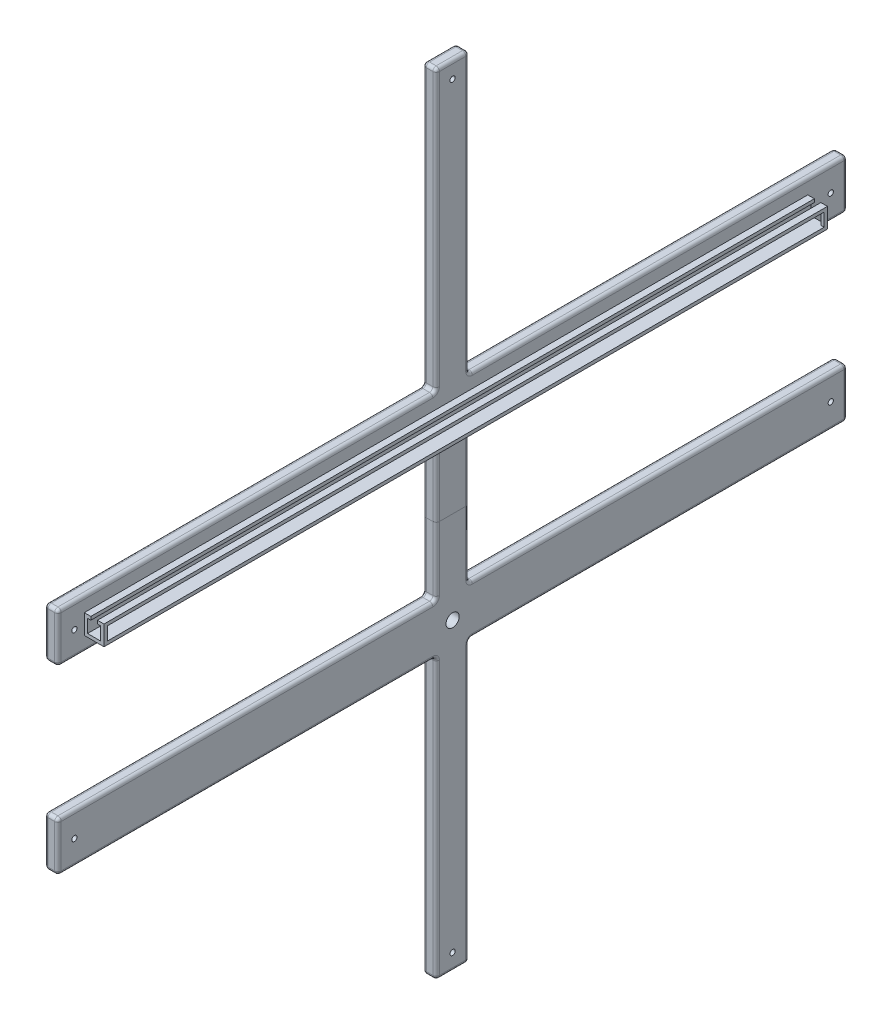
from build123d import *

# Parameters (mm, degrees)
BOSS_EXTRUDE1_DEPTH     = 4
CUT_EXTRUDE1_DEPTH      = 4
CUT_EXTRUDE1_DEPTH_BACK = 4
SKETCH4_R               = 0.8
SKETCH4_R_2             = 2
FILLET1_R               = 1
BOSS_EXTRUDE5_DEPTH     = 220
SKETCH9_W               = 218
SKETCH9_H               = 4
CUT_EXTRUDE2_DEPTH      = 2


with BuildPart() as part:
    # Sketch3 → Boss-Extrude1 (new body)
    with BuildSketch(Plane(origin=(0, 0, 0), x_dir=(0, 0, -1), z_dir=(1, 0, 0))):
        Polygon((-151.031128477, 58.486176731), (-36.031128477, 58.486176731), (-36.031128477, 43.486176731), (-151.031128477, 43.486176731), (-151.031128477, 3.486176731), (-36.031128477, 3.486176731), (-36.031128477, -11.513823269), (-151.031128477, -11.513823269), (-151.031128477, -96.513823269), (-161.031128477, -96.513823269), (-161.031128477, -11.513823269), (-276.031128477, -11.513823269), (-276.031128477, 3.486176731), (-161.031128477, 3.486176731), (-161.031128477, 43.486176731), (-276.031128477, 43.486176731), (-276.031128477, 58.486176731), (-161.031128477, 58.486176731), (-161.031128477, 143.486176731), (-151.031128477, 143.486176731), align=None)
    extrude(amount=BOSS_EXTRUDE1_DEPTH)

    # Sketch4 → Cut-Extrude1 (cut, two sides: drawn at the far end of the back side and taken through both)
    with BuildSketch(Plane(origin=(0, 0, 0), x_dir=(0, 0, -1), z_dir=(1, 0, 0)).offset(-CUT_EXTRUDE1_DEPTH_BACK)):
        with Locations((-156.031128477, -91.513823269)):
            Circle(SKETCH4_R)
        with Locations((-156.031128477, 138.486176731)):
            Circle(SKETCH4_R)
        with Locations((-271.031128477, -4.013823269)):
            Circle(SKETCH4_R)
        with Locations((-271.031128477, 50.986176731)):
            Circle(SKETCH4_R)
        with Locations((-41.031128477, -4.013823269)):
            Circle(SKETCH4_R)
        with Locations((-41.031128477, 50.986176731)):
            Circle(SKETCH4_R)
        with Locations((-156.031128477, -4.013823269)):
            Circle(SKETCH4_R_2)
        with Locations((-156.031128477, 50.986176731)):
            Circle(SKETCH4_R_2)
    extrude(amount=CUT_EXTRUDE1_DEPTH + CUT_EXTRUDE1_DEPTH_BACK, mode=Mode.SUBTRACT)

    # Fillet1
    fillet1_edges = [part.edges().sort_by_distance(p)[0] for p in [
        (2, 143.486176731, 161.031128477),
        (2, 58.486176731, 161.031128477),
        (2, 58.486176731, 276.031128477),
        (2, 43.486176731, 276.031128477),
        (2, 43.486176731, 161.031128477),
        (2, 3.486176731, 161.031128477),
        (2, 3.486176731, 276.031128477),
        (2, -11.513823269, 276.031128477),
        (2, -11.513823269, 161.031128477),
        (2, -96.513823269, 161.031128477),
        (2, -96.513823269, 151.031128477),
        (2, -11.513823269, 151.031128477),
        (2, -11.513823269, 36.031128477),
        (2, 3.486176731, 36.031128477),
        (2, 3.486176731, 151.031128477),
        (2, 43.486176731, 151.031128477),
        (2, 43.486176731, 36.031128477),
        (2, 58.486176731, 36.031128477),
        (2, 58.486176731, 151.031128477),
        (2, 143.486176731, 151.031128477),
        (4, 100.986176731, 161.031128477),
        (4, 58.486176731, 218.531128477),
        (4, 50.986176731, 276.031128477),
        (4, 43.486176731, 218.531128477),
        (4, 23.486176731, 161.031128477),
        (4, 3.486176731, 218.531128477),
        (4, -4.013823269, 276.031128477),
        (4, -11.513823269, 218.531128477),
        (4, -54.013823269, 161.031128477),
        (4, -96.513823269, 156.031128477),
        (4, -54.013823269, 151.031128477),
        (4, -11.513823269, 93.531128477),
        (4, -4.013823269, 36.031128477),
        (4, 3.486176731, 93.531128477),
        (4, 23.486176731, 151.031128477),
        (4, 43.486176731, 93.531128477),
        (4, 50.986176731, 36.031128477),
        (4, 58.486176731, 93.531128477),
        (4, 100.986176731, 151.031128477),
        (4, 143.486176731, 156.031128477),
        (0, 100.986176731, 161.031128477),
        (0, 58.486176731, 218.531128477),
        (0, 50.986176731, 276.031128477),
        (0, 43.486176731, 218.531128477),
        (0, 23.486176731, 161.031128477),
        (0, 3.486176731, 218.531128477),
        (0, -4.013823269, 276.031128477),
        (0, -11.513823269, 218.531128477),
        (0, -54.013823269, 161.031128477),
        (0, -96.513823269, 156.031128477),
        (0, -54.013823269, 151.031128477),
        (0, -11.513823269, 93.531128477),
        (0, -4.013823269, 36.031128477),
        (0, 3.486176731, 93.531128477),
        (0, 23.486176731, 151.031128477),
        (0, 43.486176731, 93.531128477),
        (0, 50.986176731, 36.031128477),
        (0, 58.486176731, 93.531128477),
        (0, 100.986176731, 151.031128477),
        (0, 143.486176731, 156.031128477),
    ]]
    fillet(fillet1_edges, radius=FILLET1_R)

    # Sketch7 → Boss-Extrude5 (add)
    with BuildSketch(Plane.XY.offset(268.031128477)):
        Polygon((6, 53.986176731), (6, 52.986176731), (5, 52.986176731), (5, 48.986176731), (9, 48.986176731), (9, 52.986176731), (8, 52.986176731), (8, 53.978716549), (10, 53.986176731), (10, 47.986176731), (4, 47.986176731), (4, 53.986176731), align=None)
    extrude(amount=-BOSS_EXTRUDE5_DEPTH)

    # Sketch9 → Cut-Extrude2 (cut)
    with BuildSketch(Plane(origin=(10, 0, 0), x_dir=(0, 0, -1), z_dir=(1, 0, 0))):
        with Locations((-158.031128477, 50.986176731)):
            Rectangle(SKETCH9_W, SKETCH9_H)
    extrude(amount=-CUT_EXTRUDE2_DEPTH, mode=Mode.SUBTRACT)


with BuildPart() as body_2:
    # Split1: the piece on the far side of the plane
    add(part.part)
    split(bisect_by=Plane(origin=(0, 23.986176731, 0), x_dir=(0, 0, -1), z_dir=(0, -1, 0)), keep=Keep.BOTTOM)


with BuildPart() as part_1:
    add(part.part)

    # Split1
    split(bisect_by=Plane(origin=(0, 23.986176731, 0), x_dir=(0, 0, -1), z_dir=(0, -1, 0)), keep=Keep.TOP)


solid = Compound([body_2.part, part_1.part])
